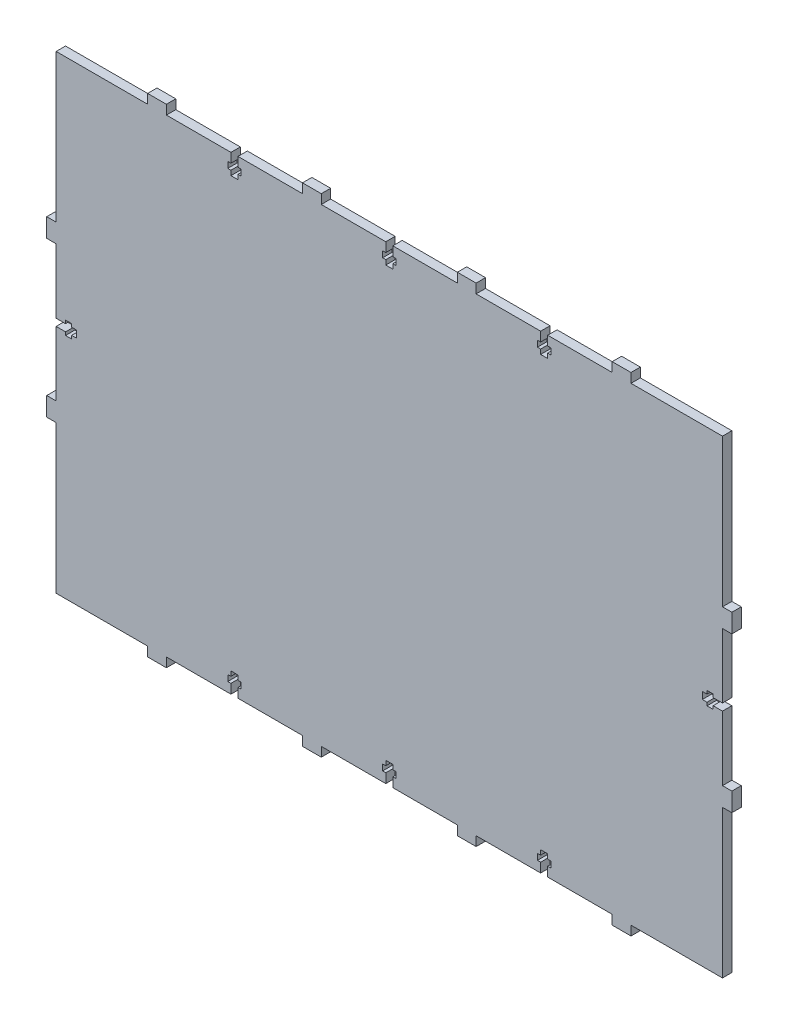
from build123d import *

# Parameters (mm, degrees)
EXTRUDE_1_DEPTH = 4


with BuildPart() as part:
    # 草图1 → 凸台-拉伸1 (new body)
    with BuildSketch(Plane.XY):
        Polygon((0, 0), (0, -4), (-1.35, -4), (-1.35, -6.6), (0, -6.6), (0, -8.6), (3, -8.6), (3, -6.6), (4.35, -6.6), (4.35, -4), (3, -4), (3, 0), (30.5, 0), (30.5, 4), (38.5, 4), (38.5, 0), (66, 0), (66, -4), (64.65, -4), (64.65, -6.6), (66, -6.6), (66, -8.6), (69, -8.6), (69, -6.6), (70.35, -6.6), (70.35, -4), (69, -4), (69, 0), (96.5, 0), (96.5, 4), (104.5, 4), (104.5, 0), (132, 0), (143.5, 0), (143.5, -63), (147.5, -63), (147.5, -71), (143.5, -71), (143.5, -98.5), (139.5, -98.5), (139.5, -97.15), (136.9, -97.15), (136.9, -98.5), (134.9, -98.5), (134.9, -101.5), (136.9, -101.5), (136.9, -102.85), (139.5, -102.85), (139.5, -101.5), (143.5, -101.5), (143.5, -129), (147.5, -129), (147.5, -137), (143.5, -137), (143.5, -200), (132, -200), (104.5, -200), (104.5, -204), (96.5, -204), (96.5, -200), (69, -200), (69, -196), (70.35, -196), (70.35, -193.4), (69, -193.4), (69, -191.4), (66, -191.4), (66, -193.4), (64.65, -193.4), (64.65, -196), (66, -196), (66, -200), (38.5, -200), (38.5, -204), (30.5, -204), (30.5, -200), (3, -200), (3, -196), (4.35, -196), (4.35, -193.4), (3, -193.4), (3, -191.4), (0, -191.4), (0, -193.4), (-1.35, -193.4), (-1.35, -196), (0, -196), (0, -200), (-27.5, -200), (-27.5, -204), (-35.5, -204), (-35.5, -200), (-63, -200), (-63, -196), (-61.65, -196), (-61.65, -193.4), (-63, -193.4), (-63, -191.4), (-66, -191.4), (-66, -193.4), (-67.35, -193.4), (-67.35, -196), (-66, -196), (-66, -200), (-93.5, -200), (-93.5, -204), (-101.5, -204), (-101.5, -200), (-129, -200), (-140.5, -200), (-140.5, -137), (-144.5, -137), (-144.5, -129), (-140.5, -129), (-140.5, -101.5), (-136.5, -101.5), (-136.5, -102.85), (-133.9, -102.85), (-133.9, -101.5), (-131.9, -101.5), (-131.9, -98.5), (-133.9, -98.5), (-133.9, -97.15), (-136.5, -97.15), (-136.5, -98.5), (-140.5, -98.5), (-140.5, -71), (-144.5, -71), (-144.5, -63), (-140.5, -63), (-140.5, 0), (-129, 0), (-101.5, 0), (-101.5, 4), (-93.5, 4), (-93.5, 0), (-66, 0), (-66, -4), (-67.35, -4), (-67.35, -6.6), (-66, -6.6), (-66, -8.6), (-63, -8.6), (-63, -6.6), (-61.65, -6.6), (-61.65, -4), (-63, -4), (-63, 0), (-35.5, 0), (-35.5, 4), (-27.5, 4), (-27.5, 0), align=None)
    extrude(amount=EXTRUDE_1_DEPTH)


solid = part.part
